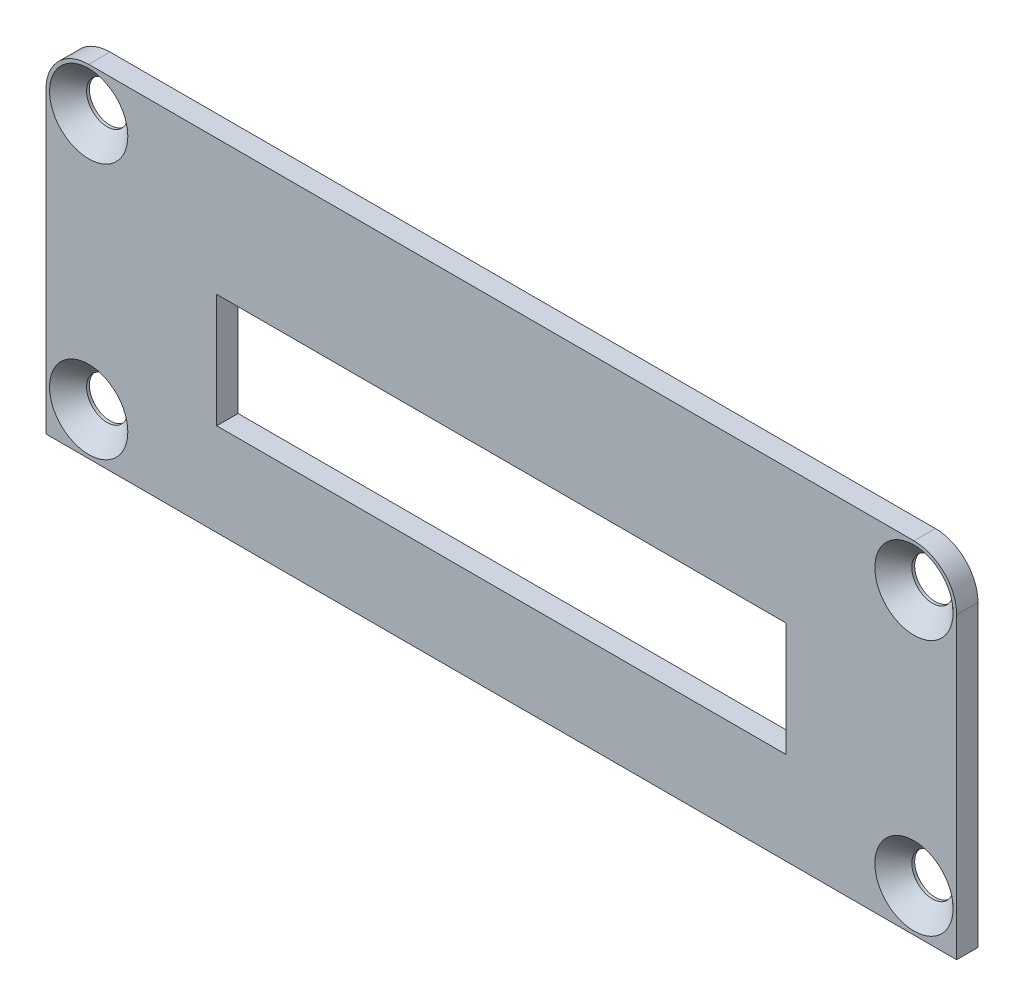
from build123d import *

# Parameters (mm, degrees)
SKETCH1_W                                      = 64
SKETCH1_H                                      = 24
BOSS_EXTRUDE1_DEPTH                            = 1.5
SKETCH2_W                                      = 40
SKETCH2_H                                      = 8
CUT_EXTRUDE1_DEPTH                             = 35.208916966
FILLET1_R                                      = 3
CSK_FOR_M2_5_FLAT_HEAD_MACHINE_SCREW1_AT_COUNT = 2
CSK_FOR_M2_5_FLAT_HEAD_MACHINE_SCREW1_AT_PITCH = 58
CSK_FOR_M2_5_FLAT_HEAD_MACHINE_SCREW_2_COUNT   = 2
CSK_FOR_M2_5_FLAT_HEAD_MACHINE_SCREW_2_PITCH   = 18
CSK_FOR_M2_5_FLAT_HEAD_MACHINE_SCREW_3_COUNT   = 2
CSK_FOR_M2_5_FLAT_HEAD_MACHINE_SCREW_3_PITCH   = 60.728905803


with BuildPart() as part:
    # Sketch1 → Boss-Extrude1 (new body)
    with BuildSketch(Plane.XY):
        Rectangle(SKETCH1_W, SKETCH1_H)
    extrude(amount=-BOSS_EXTRUDE1_DEPTH)

    # Sketch2 → Cut-Extrude1 (cut, through all)
    with BuildSketch(Plane.XY):
        with Locations((0, -1.5)):
            Rectangle(SKETCH2_W, SKETCH2_H)
    extrude(amount=-CUT_EXTRUDE1_DEPTH, mode=Mode.SUBTRACT)

    # Fillet1
    fillet1_edges = [part.edges().sort_by_distance(p)[0] for p in [
        (-32, 12, -0.75),
        (32, 12, -0.75),
    ]]
    fillet(fillet1_edges, radius=FILLET1_R)

    # Sketch3 → CSK for M2.5 Flat Head Machine Screw1 (revolve, cut)
    with BuildSketch(Plane(origin=(-29, 9, 0), x_dir=(0, -1, 0), z_dir=(1, 0, 0))):
        Polygon((0, 0), (0, 1.5), (1.45, 1.5), (1.45, 1.3), (2.75, 0), align=None)
    csk_for_m2_5_flat_head_machine_screw1 = revolve(axis=Axis((-29, 9, 6.35), (0, 0, -1)), mode=Mode.SUBTRACT)

    # CSK for M2.5 Flat Head Machine Screw1 at: CSK for M2.5 Flat Head Machine Screw1 ×2
    with Locations(*[(i * CSK_FOR_M2_5_FLAT_HEAD_MACHINE_SCREW1_AT_PITCH, 0, 0) for i in range(1, CSK_FOR_M2_5_FLAT_HEAD_MACHINE_SCREW1_AT_COUNT)]):
        add(csk_for_m2_5_flat_head_machine_screw1, mode=Mode.SUBTRACT)

    # CSK for M2.5 Flat Head Machine Screw 2: CSK for M2.5 Flat Head Machine Screw1 ×2
    with Locations(*[(0, -i * CSK_FOR_M2_5_FLAT_HEAD_MACHINE_SCREW_2_PITCH, 0) for i in range(1, CSK_FOR_M2_5_FLAT_HEAD_MACHINE_SCREW_2_COUNT)]):
        add(csk_for_m2_5_flat_head_machine_screw1, mode=Mode.SUBTRACT)

    # CSK for M2.5 Flat Head Machine Screw 3: CSK for M2.5 Flat Head Machine Screw1 ×2
    with Locations(*[Vector(0.9550641368112371, -0.29639921487245297, 0) * (i * CSK_FOR_M2_5_FLAT_HEAD_MACHINE_SCREW_3_PITCH) for i in range(1, CSK_FOR_M2_5_FLAT_HEAD_MACHINE_SCREW_3_COUNT)]):
        add(csk_for_m2_5_flat_head_machine_screw1, mode=Mode.SUBTRACT)


solid = part.part
